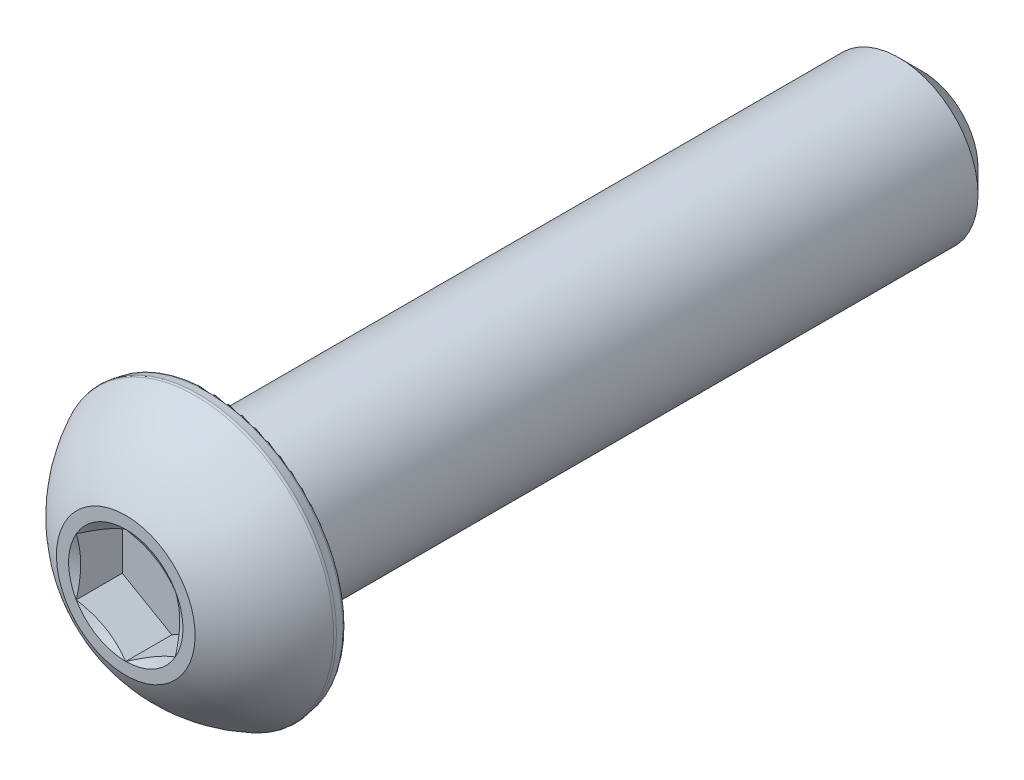
from build123d import *

# Parameters (mm, degrees)
CUT_EXTRUDE1_DEPTH = 1.84404
FILLET1_R          = 0.16764


with BuildPart() as part:
    # Sketch3 → Revolve1 (revolve)
    with BuildSketch(Plane(origin=(0, 0, 0), x_dir=(0, 0, -1), z_dir=(1, 0, 0)), mode=Mode.PRIVATE) as revolve1_sk:
        with BuildLine():
            Line((-15.9639, 0), (-15.9639, 2.778125))
            ThreePointArc((-15.9639, 2.778125), (-14.769524687, 4.401074199), (-13.11402, 5.5499))
            Line((-13.11402, 5.5499), (-12.6111, 5.461221635))
            Line((-12.6111, 5.461221635), (-12.6111, 3.175))
            Line((-12.6111, 3.175), (15.0114, 3.175))
            Line((15.0114, 3.175), (15.9639, 2.2225))
            Line((15.9639, 2.2225), (15.9639, 0))
            Line((15.9639, 0), (-15.9639, 0))
        make_face()
    revolve(revolve1_sk.sketch.rotate(Axis((0, 0, 15.9639), (0, 0, -1)), 90), axis=Axis((0, 0, 15.9639), (0, 0, -1)))

    # Sketch4 → Cut-Extrude1 (cut)
    with BuildSketch(Plane.XY.offset(15.9639)):
        Polygon((-1.984375, -1.14567944), (0, -2.291358881), (1.984375, -1.14567944), (1.984375, 1.14567944), (0, 2.291358881), (-1.984375, 1.14567944), align=None)
    extrude(amount=-CUT_EXTRUDE1_DEPTH, mode=Mode.SUBTRACT)

    # Cut-Extrude2 cone 1 section (through the dimple's axis) → Cut-Extrude2 (revolve, cut)
    with BuildSketch(Plane(origin=(0, 0, 15.9639), x_dir=(0, -1, 0), z_dir=(1, 0, 0))):
        Polygon((0, 0), (2.291358881, 0), (0, 1.322916667), align=None)
    revolve(axis=Axis((0, 0, 15.9639), (0, 0, -1)), mode=Mode.SUBTRACT)

    # Fillet1
    fillet1_edges = [part.edges().sort_by_distance(p)[0] for p in [
        (-5.461221635, 0, 12.6111),
        (-5.5499, 0, 13.11402),
    ]]
    fillet(fillet1_edges, radius=FILLET1_R)


solid = part.part
